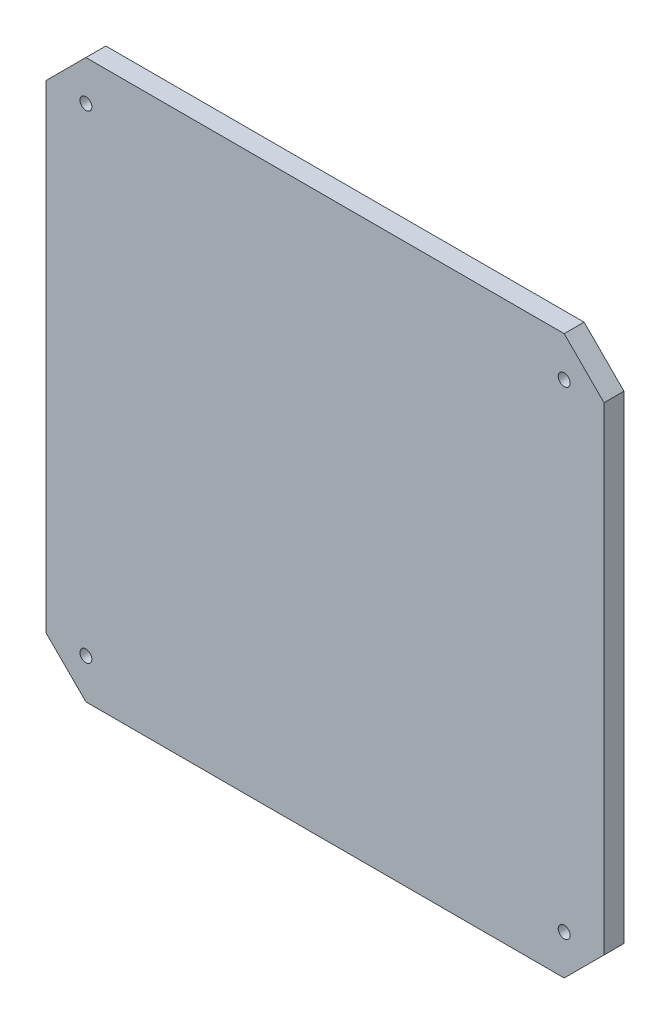
from build123d import *

# Parameters (mm, degrees)
SKETCH1_R           = 3.81
BOSS_EXTRUDE1_DEPTH = 12.7


with BuildPart() as part:
    # Sketch1 → Boss-Extrude1 (new body)
    with BuildSketch(Plane.XY):
        Polygon((-177.8, 152.4), (-152.4, 177.8), (152.4, 177.8), (177.8, 152.4), (177.8, -152.4), (152.4, -177.8), (-152.4, -177.8), (-177.8, -152.4), align=None)
        with Locations((-152.4, 152.4)):
            Circle(SKETCH1_R, mode=Mode.SUBTRACT)
        with Locations((152.4, 152.4)):
            Circle(SKETCH1_R, mode=Mode.SUBTRACT)
        with Locations((152.4, -152.4)):
            Circle(SKETCH1_R, mode=Mode.SUBTRACT)
        with Locations((-152.4, -152.4)):
            Circle(SKETCH1_R, mode=Mode.SUBTRACT)
    extrude(amount=BOSS_EXTRUDE1_DEPTH)


solid = part.part
